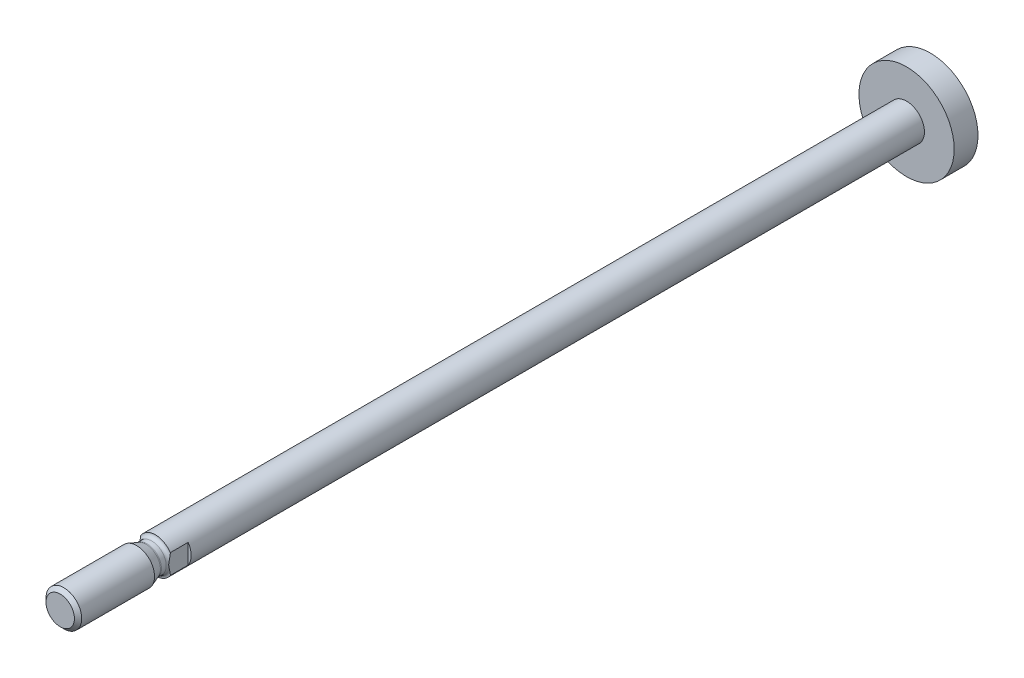
from build123d import *

# Parameters (mm, degrees)
SCHNITT_LINEAR_AUSTRAGEN1_DEPTH = 4


with BuildPart() as part:
    # Skizze1 → Rotation1 (revolve)
    with BuildSketch(Plane(origin=(0, 0, 0), x_dir=(0, 0, -1), z_dir=(1, 0, 0))):
        Polygon((-5, 0), (-5, 3), (121.2, 3), (121.2, 8), (125.2, 8), (125.2, 0), align=None)
    revolve(axis=Axis((0, 0, -125.2), (0, 0, 1)))

    # Skizze2 → Rotation2 (revolve)
    with BuildSketch(Plane(origin=(0, 0, 0), x_dir=(0, 0, -1), z_dir=(1, 0, 0))):
        with BuildLine():
            Line((-21, 0), (-21, 2.3865))
            Line((-21, 2.3865), (-20.3865, 3))
            Line((-20.3865, 3), (-8.148486452, 3))
            Line((-8.148486452, 3), (-6.599415898, 2.436184428))
            ThreePointArc((-6.599415898, 2.436184428), (-6.498392718, 2.409115348), (-6.394203812, 2.4))
            Line((-6.394203812, 2.4), (-5.6, 2.4))
            ThreePointArc((-5.6, 2.4), (-5.175735931, 2.575735931), (-5, 3))
            Line((-5, 3), (-4, 3))
            Line((-4, 3), (-4, 0))
            Line((-4, 0), (-21, 0))
        make_face()
    revolve(axis=Axis((0, 0, 4), (0, 0, 1)))

    # Skizze3 → Schnitt-Linear austragen1 (cut)
    with BuildSketch(Plane.XY.offset(2)):
        Polygon((-5, 10), (-5, -5), (-2.5, -5), (-2.5, 5), (2.5, 5), (2.5, -5), (5, -5), (5, 10), align=None)
    extrude(amount=SCHNITT_LINEAR_AUSTRAGEN1_DEPTH, mode=Mode.SUBTRACT)


solid = part.part
